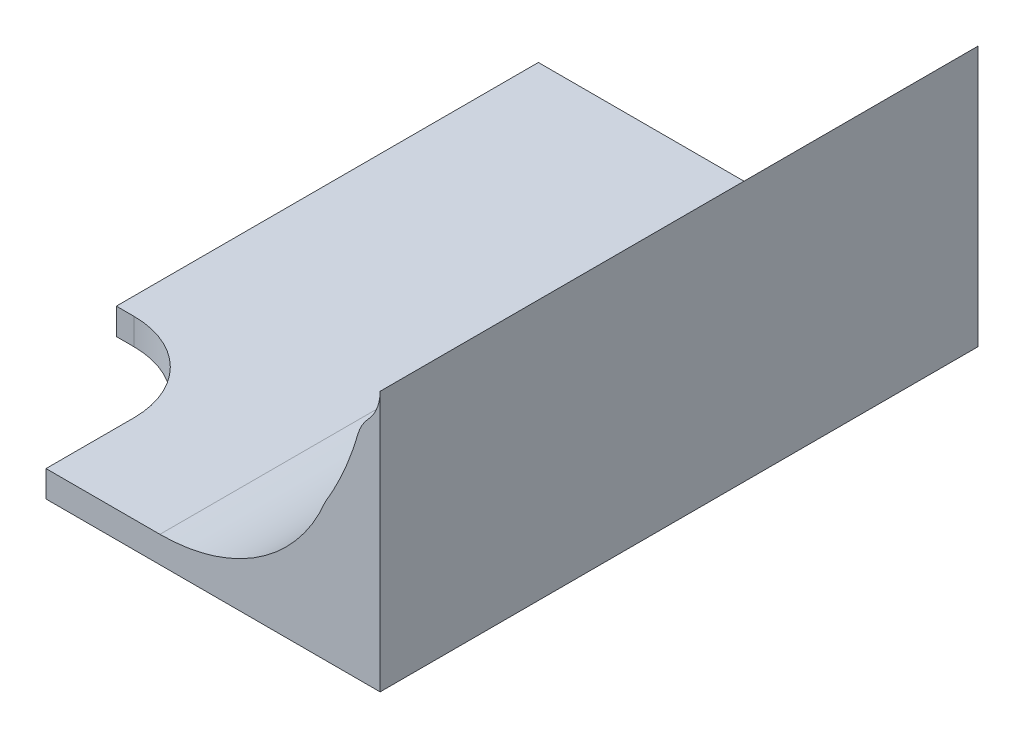
from build123d import *

# Parameters (mm, degrees)
BOSS_EXTRUDE1_DEPTH = 68
CUT_EXTRUDE1_DEPTH  = 10


with BuildPart() as part:
    # Sketch2 → Boss-Extrude1 (new body)
    with BuildSketch(Plane.XY):
        with BuildLine():
            Line((-46.657067634, -11.60759921), (-71.613281954, -11.60759921))
            Line((-71.613281954, -11.60759921), (-71.613281954, -14.607279662))
            Line((-71.613281954, -14.607279662), (-21.613281954, -14.607279662))
            Line((-21.613281954, -14.607279662), (-21.613281954, 15.004436623))
            ThreePointArc((-21.613281954, 15.004436623), (-21.964992236, 13.162317544), (-22.970643034, 11.579355354))
            ThreePointArc((-22.970643034, 11.579355354), (-23.673981627, 10.626616994), (-24.133529038, 9.535190525))
            ThreePointArc((-24.133529038, 9.535190525), (-25.71874065, 5.128724796), (-27.866056136, 0.967129876))
            ThreePointArc((-27.866056136, 0.967129876), (-35.351914775, -8.173910524), (-46.657067634, -11.60759921))
        make_face()
    extrude(amount=BOSS_EXTRUDE1_DEPTH)

    # Sketch3 → Cut-Extrude1 (cut)
    with BuildSketch(Plane(origin=(0, -14.607279662, 0), x_dir=(-1, 0, 0), z_dir=(0, -1, 0))):
        with BuildLine():
            Line((71.613281954, -68), (59.613281954, -68))
            Line((59.613281954, -68), (59.613281954, -58))
            ThreePointArc((59.613281954, -58), (62.542214142, -50.928932188), (69.613281954, -48))
            Line((69.613281954, -48), (71.613281954, -48))
            Line((71.613281954, -48), (71.613281954, -68))
        make_face()
    extrude(amount=-CUT_EXTRUDE1_DEPTH, mode=Mode.SUBTRACT)


solid = part.part
